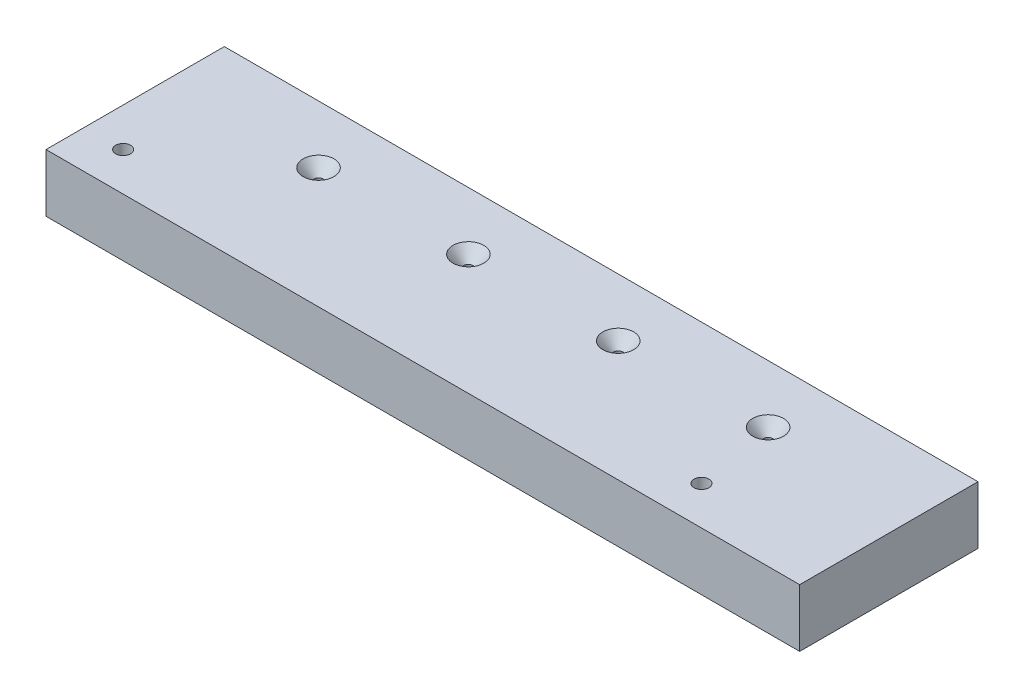
from build123d import *

# Parameters (mm, degrees)
SKETCH1_W             = 248.25
SKETCH1_H             = 19.05
BOSS_EXTRUDE1_DEPTH   = 38.1
HOLE1_D               = 3.175
HOLE1_DEPTH           = 31.75
HOLE1_CSINK_D         = 10.16
HOLE1_CSINK_ANGLE     = 82
HOLE1_TIP             = 0.953866233
HOLE2_D               = 3.175
HOLE2_DEPTH           = 57.15
HOLE2_CSINK_D         = 10.16
HOLE2_CSINK_ANGLE     = 82
HOLE2_TIP             = 0.953866233
SKETCH6_W             = 248.25
SKETCH6_H             = 20.637862114
BOSS_EXTRUDE3_DEPTH   = 19.05
F_8_CLEARANCE_HOLE1_D = 4.9149


with BuildPart() as part:
    # Sketch1 → Boss-Extrude1 (new body)
    with BuildSketch(Plane.XY):
        with Locations((124.125, 47.625)):
            Rectangle(SKETCH1_W, SKETCH1_H)
    extrude(amount=BOSS_EXTRUDE1_DEPTH)

    # Hole1
    with Locations(Plane(origin=(-1090.512770337, -52.974999997, -12.7), x_dir=(0, 1, 0), z_dir=(0, 0, -1))):
        with Locations((-100.332047386, 1313.362770337), (100.599999997, 1313.362770337), (100.599999997, 1115.912770337), (100.599999997, 1214.637770337), (-100.332047386, 1214.637770337), (-100.332047386, 1115.912770337)):
            CounterSinkHole(HOLE1_D / 2, HOLE1_CSINK_D / 2, depth=HOLE1_DEPTH, counter_sink_angle=HOLE1_CSINK_ANGLE)
            with Locations((0, 0, -(HOLE1_DEPTH + HOLE1_TIP / 2))):  # 118° drill point
                Cone(0, HOLE1_D / 2, HOLE1_TIP, mode=Mode.SUBTRACT)

    # Hole2
    with Locations(Plane(origin=(-1090.512770337, 57.15, -415.792401694), x_dir=(0.3746065934159092, 0, 0.9271838545667885), z_dir=(0, 1, 0))):
        with Locations((848.944412528, 940.413642522), (885.927448463, 1031.949868564), (867.435930496, 986.181755543), (830.452894561, 894.645529501)):
            CounterSinkHole(HOLE2_D / 2, HOLE2_CSINK_D / 2, depth=HOLE2_DEPTH, counter_sink_angle=HOLE2_CSINK_ANGLE)
            with Locations((0, 0, -(HOLE2_DEPTH + HOLE2_TIP / 2))):  # 118° drill point
                Cone(0, HOLE2_D / 2, HOLE2_TIP, mode=Mode.SUBTRACT)

    # Sketch6 → Boss-Extrude3 (add)
    with BuildSketch(Plane(origin=(0, 57.15, 0), x_dir=(1, 0, 0), z_dir=(0, 1, 0))):
        with Locations((124.125, -48.418931057)):
            Rectangle(SKETCH6_W, SKETCH6_H)
    extrude(amount=-BOSS_EXTRUDE3_DEPTH)

    # #8 Clearance Hole1 (through all)
    with Locations(Plane(origin=(0, 57.15, 0), x_dir=(1, 0, 0), z_dir=(0, 1, 0))):
        with Locations((12.7, -46.037862114), (203.2, -46.037862114)):
            Hole(F_8_CLEARANCE_HOLE1_D / 2)


solid = part.part
